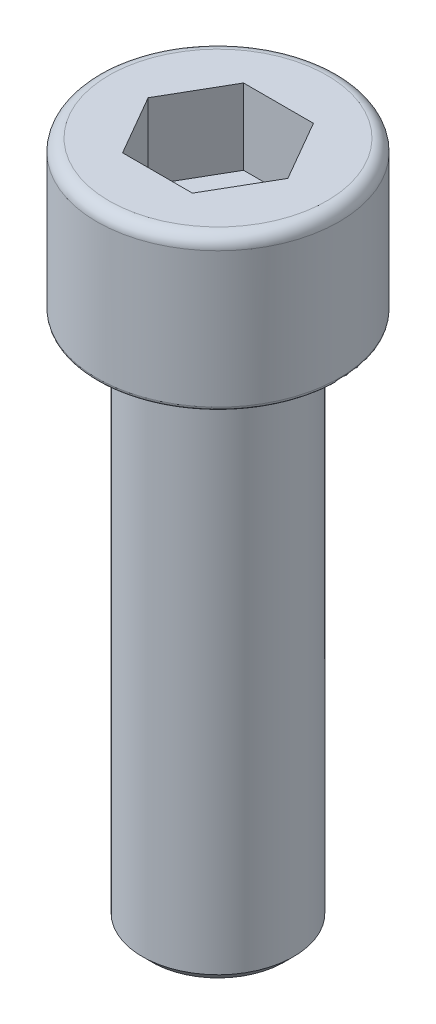
from build123d import *

# Parameters (mm, degrees)
CUT_EXTRUDE1_DEPTH = 5
FILLET3_R          = 0.8
CHAMFER1_SIZE      = 0.625
FILLET4_R          = 0.25


with BuildPart() as part:
    # Sketch1 → Revolve1 (revolve)
    with BuildSketch(Plane.XY, mode=Mode.PRIVATE) as revolve1_sk:
        Polygon((0, 0), (8, 0), (8, -10), (5, -10), (5, -45), (0, -45), align=None)
    revolve(revolve1_sk.sketch.rotate(Axis((0, -50, 0), (0, 1, 0)), 90), axis=Axis((0, -50, 0), (0, 1, 0)))

    # Sketch2 → Cut-Extrude1 (cut)
    with BuildSketch(Plane(origin=(0, 0, 0), x_dir=(1, 0, 0), z_dir=(0, 1, 0))):
        Polygon((4.618802154, 0), (2.309401077, 4), (-2.309401077, 4), (-4.618802154, 0), (-2.309401077, -4), (2.309401077, -4), align=None)
    extrude(amount=-CUT_EXTRUDE1_DEPTH, mode=Mode.SUBTRACT)

    # Fillet3
    fillet3_edges = [part.edges().sort_by_distance(p)[0] for p in [
        (0, 0, 8),
    ]]
    fillet(fillet3_edges, radius=FILLET3_R)

    # Chamfer1
    chamfer1_edges = [part.edges().sort_by_distance(p)[0] for p in [
        (0, -45, 5),
    ]]
    chamfer(chamfer1_edges, length=CHAMFER1_SIZE)

    # Fillet4
    fillet4_edges = [part.edges().sort_by_distance(p)[0] for p in [
        (0, -10, 5),
        (0, -10, 8),
    ]]
    fillet(fillet4_edges, radius=FILLET4_R)


solid = part.part
